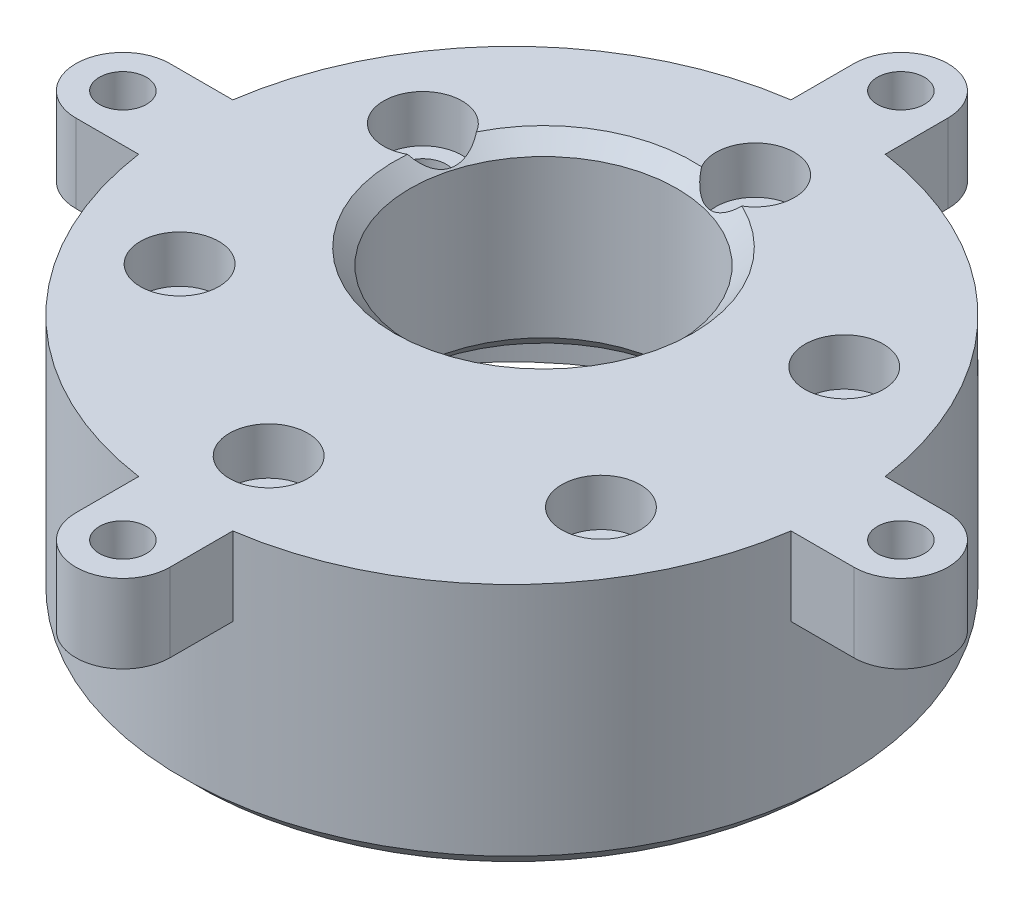
from build123d import *

# Parameters (mm, degrees)
SKETCH1_R                    = 19
SKETCH1_R_2                  = 1.5
SKETCH1_R_3                  = 8.5
BOSS_EXTRUDE1_DEPTH          = 12
BOSS_EXTRUDE2_DEPTH          = 4
BOSS_EXTRUDE2_DEPTH_BACK     = 12
SKETCH2_R                    = 21
SKETCH2_R_2                  = 19
BOSS_EXTRUDE3_START          = -5
SKETCH3_R                    = 3
SKETCH3_R_2                  = 1.5
BOSS_EXTRUDE3_DEPTH          = 5
CHAMFER1_SIZE                = 1
CIRPATTERN2_COUNT            = 4
CHAMFER1_OF_CIRPATTERN2_SIZE = 1
CHAMFER3_SIZE                = 1
SKETCH4_R                    = 2.5
CUT_EXTRUDE1_DEPTH           = 3


with BuildPart() as part:
    # Sketch1 → Boss-Extrude1 (new body)
    with BuildSketch(Plane(origin=(0, 0, 0), x_dir=(1, 0, 0), z_dir=(0, 1, 0))):
        with Locations(Location((0, 0, 0), (0, 0, 270))):
            Circle(SKETCH1_R)
        with Locations(Location((0, 15.5, 0), (0, 0, 270))):
            Circle(SKETCH1_R_2, mode=Mode.SUBTRACT)
        with Locations(Location((13.423393759, 7.75, 0), (0, 0, 270))):
            Circle(SKETCH1_R_2, mode=Mode.SUBTRACT)
        with Locations(Location((13.423393759, -7.75, 0), (0, 0, 270))):
            Circle(SKETCH1_R_2, mode=Mode.SUBTRACT)
        with Locations(Location((0, -15.5, 0), (0, 0, 270))):
            Circle(SKETCH1_R_2, mode=Mode.SUBTRACT)
        with Locations(Location((-13.423393759, -7.75, 0), (0, 0, 270))):
            Circle(SKETCH1_R_2, mode=Mode.SUBTRACT)
        with Locations(Location((-13.423393759, 7.75, 0), (0, 0, 270))):
            Circle(SKETCH1_R_2, mode=Mode.SUBTRACT)
        with Locations(Location((-2.75, 4.763139721, 0), (0, 0, 270))):
            Circle(SKETCH1_R_3, mode=Mode.SUBTRACT)
    extrude(amount=BOSS_EXTRUDE1_DEPTH)

    # Sketch2 → Boss-Extrude2 (add, two sides: drawn at the far end of the back side and taken through both)
    with BuildSketch(Plane.XZ.offset(-BOSS_EXTRUDE2_DEPTH_BACK)):
        with Locations(Location((0, 0, 0), (0, 0, 270))):
            Circle(SKETCH2_R)
        with Locations(Location((0, 0, 0), (0, 0, 270))):
            Circle(SKETCH2_R_2, mode=Mode.SUBTRACT)
    extrude(amount=BOSS_EXTRUDE2_DEPTH + BOSS_EXTRUDE2_DEPTH_BACK)

    # Sketch3 → Boss-Extrude3 (add)
    # profile 1 of 2: a face of its own
    with BuildSketch(Plane(origin=(0, 12, 0), x_dir=(1, 0, 0), z_dir=(0, 1, 0)).offset(BOSS_EXTRUDE3_START)):
        with Locations((0, 24.784609691)):
            Circle(SKETCH3_R)
        with Locations(Location((0, 24.784609691, 0), (0, 0, 270))):
            Circle(SKETCH3_R_2, mode=Mode.SUBTRACT)
    # profile 2 of 2: a face of its own
    with BuildSketch(Plane(origin=(0, 12, 0), x_dir=(1, 0, 0), z_dir=(0, 1, 0)).offset(BOSS_EXTRUDE3_START)):
        with BuildLine():
            ThreePointArc((3, 24.784609691), (0, 21.784609691), (-3, 24.784609691))
            Line((-3, 24.784609691), (-3, 20.784609691))
            ThreePointArc((-3, 20.784609691), (0, 21), (3, 20.784609691))
            Line((3, 20.784609691), (3, 24.784609691))
        make_face()
    boss_extrude3 = extrude(amount=BOSS_EXTRUDE3_DEPTH)

    # Chamfer1
    chamfer1_edges = [part.edges().sort_by_distance(p)[0] for p in [
        (0, 7, -26.284609691),
    ]]
    chamfer(chamfer1_edges, length=CHAMFER1_SIZE)

    # CirPattern2: Boss-Extrude3 ×4 about axis
    cirpattern2_axis = Axis((0, 0, 0), (0, 1, 0))
    for i in range(1, CIRPATTERN2_COUNT):
        add(boss_extrude3.rotate(cirpattern2_axis, i * 360 / CIRPATTERN2_COUNT))

    # Chamfer1 of CirPattern2
    chamfer1_of_cirpattern2_edges = [part.edges().sort_by_distance(p)[0] for p in [
        (-26.284609691, 7, 0),
        (0, 7, 26.284609691),
        (26.284609691, 7, 0),
    ]]
    chamfer(chamfer1_of_cirpattern2_edges, length=CHAMFER1_OF_CIRPATTERN2_SIZE)

    # Chamfer3
    chamfer3_edges = [part.edges().sort_by_distance(p)[0] for p in [
        (0, -4, 21),
        (-2.75, 0, -13.263139721),
        (-2.75, 12, -13.263139721),
    ]]
    chamfer(chamfer3_edges, length=CHAMFER3_SIZE)

    # Sketch4 → Cut-Extrude1 (cut)
    with BuildSketch(Plane(origin=(0, 12, 0), x_dir=(1, 0, 0), z_dir=(0, 1, 0))):
        with Locations(Location((-13.423393759, -7.75, 0), (0, 0, 270))):
            Circle(SKETCH4_R)
        with Locations(Location((-13.423393759, 7.75, 0), (0, 0, 270))):
            Circle(SKETCH4_R)
        with Locations(Location((0, 15.5, 0), (0, 0, 270))):
            Circle(SKETCH4_R)
        with Locations(Location((13.423393759, 7.75, 0), (0, 0, 270))):
            Circle(SKETCH4_R)
        with Locations(Location((13.423393759, -7.75, 0), (0, 0, 270))):
            Circle(SKETCH4_R)
        with Locations(Location((0, -15.5, 0), (0, 0, 270))):
            Circle(SKETCH4_R)
    extrude(amount=-CUT_EXTRUDE1_DEPTH, mode=Mode.SUBTRACT)


solid = part.part
